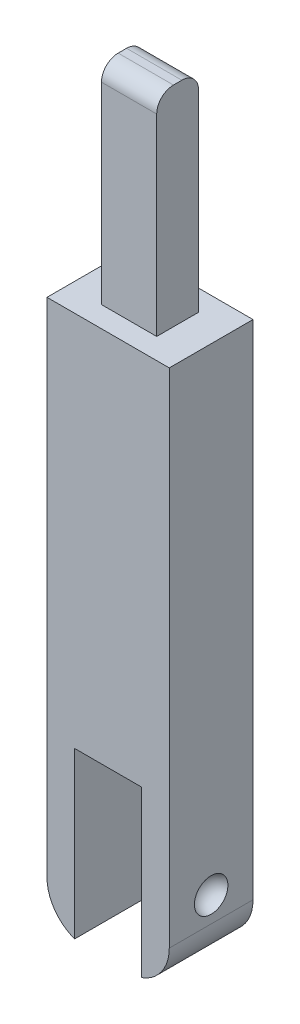
from build123d import *

# Parameters (mm, degrees)
SKETCH1_W           = 14.6
SKETCH1_H           = 90
BOSS_EXTRUDE1_DEPTH = 5
FILLET1_R           = 5
SKETCH6_W           = 4
SKETCH6_H           = 25
CUT_EXTRUDE1_DEPTH  = 52.510096098
SKETCH7_W           = 2.5
SKETCH7_H           = 25
CUT_EXTRUDE2_DEPTH  = 52.355233424
FILLET4_R           = 2
SKETCH8_W           = 8
SKETCH8_H           = 20
CUT_EXTRUDE3_DEPTH  = 52.510096098


with BuildPart() as part:
    # Sketch1 → Boss-Extrude1 (new, symmetric)
    with BuildSketch(Plane.XY):
        with Locations((0, 5)):
            Rectangle(SKETCH1_W, SKETCH1_H)
    extrude(amount=BOSS_EXTRUDE1_DEPTH, both=True)

    # Fillet1
    fillet1_edges = [part.edges().sort_by_distance(p)[0] for p in [
        (7.3, -40, 0),
        (-7.3, -40, 0),
    ]]
    fillet(fillet1_edges, radius=FILLET1_R)

    # Sketch4 → Cut-Revolve2 (revolve, cut)
    with BuildSketch(Plane.XY):
        with BuildLine():
            Line((-7.3, -32), (-5.3, -32))
            ThreePointArc((-5.3, -32), (-5.885786438, -30.585786438), (-7.3, -30))
            Line((-7.3, -30), (-7.3, -32))
        make_face()
        with BuildLine():
            Line((7.3, -32), (5.3, -32))
            ThreePointArc((5.3, -32), (5.885786438, -30.585786438), (7.3, -30))
            Line((7.3, -30), (7.3, -32))
        make_face()
    revolve(axis=Axis((-17.666251228, -32, 0), (1, 0, 0)), mode=Mode.SUBTRACT)

    # Sketch6 → Cut-Extrude1 (cut, through all)
    with BuildSketch(Plane.XY.offset(5)):
        with Locations((-5.3, 37.5)):
            Rectangle(SKETCH6_W, SKETCH6_H)
        with Locations((5.3, 37.5)):
            Rectangle(SKETCH6_W, SKETCH6_H)
    extrude(amount=-CUT_EXTRUDE1_DEPTH, mode=Mode.SUBTRACT)

    # Sketch7 → Cut-Extrude2 (cut, through all)
    with BuildSketch(Plane(origin=(3.3, 0, 0), x_dir=(0, 0, -1), z_dir=(1, 0, 0))):
        with Locations((-3.75, 37.5)):
            Rectangle(SKETCH7_W, SKETCH7_H)
        with Locations((3.75, 37.5)):
            Rectangle(SKETCH7_W, SKETCH7_H)
    extrude(amount=-CUT_EXTRUDE2_DEPTH, mode=Mode.SUBTRACT)

    # Fillet4
    fillet4_edges = [part.edges().sort_by_distance(p)[0] for p in [
        (0, 50, 2.5),
        (0, 50, -2.5),
    ]]
    fillet(fillet4_edges, radius=FILLET4_R)

    # Sketch8 → Cut-Extrude3 (cut, through all)
    with BuildSketch(Plane(origin=(0, 0, -5), x_dir=(-1, 0, 0), z_dir=(0, 0, -1))):
        with Locations((0, -30)):
            Rectangle(SKETCH8_W, SKETCH8_H)
    extrude(amount=-CUT_EXTRUDE3_DEPTH, mode=Mode.SUBTRACT)


solid = part.part
